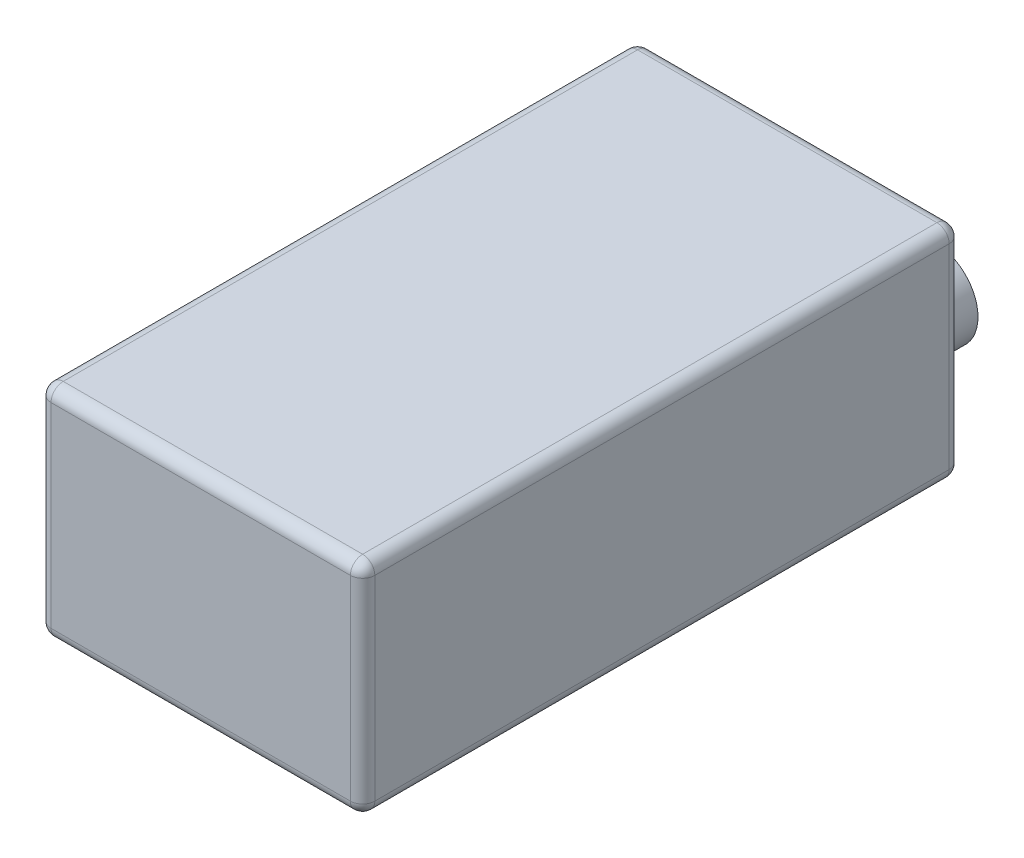
from build123d import *

# Parameters (mm, degrees)
ESQUISSE1_W        = 26.5
ESQUISSE1_H        = 49
BOSS_EXTRU_1_DEPTH = 18
CONG_1_R           = 1
ESQUISSE2_R        = 3.5
BOSS_EXTRU_2_DEPTH = 3


with BuildPart() as part:
    # Esquisse1 → Boss.-Extru.1 (new body)
    with BuildSketch(Plane(origin=(0, 0, 0), x_dir=(1, 0, 0), z_dir=(0, 1, 0))):
        Rectangle(ESQUISSE1_W, ESQUISSE1_H)
    extrude(amount=BOSS_EXTRU_1_DEPTH)

    # Congé1
    cong_1_edges = [part.edges().sort_by_distance(p)[0] for p in [
        (-13.25, 18, 0),
        (0, 18, 24.5),
        (13.25, 18, 0),
        (0, 0, 24.5),
        (-13.25, 0, 0),
        (0, 0, -24.5),
        (13.25, 0, 0),
        (13.25, 9, 24.5),
        (-13.25, 9, 24.5),
        (-13.25, 9, -24.5),
        (13.25, 9, -24.5),
        (0, 18, -24.5),
    ]]
    fillet(cong_1_edges, radius=CONG_1_R)

    # Esquisse2 → Boss.-Extru.2 (add)
    with BuildSketch(Plane(origin=(0, 0, -24.5), x_dir=(-1, 0, 0), z_dir=(0, 0, -1))):
        with Locations(Location((-8.113267723, 9, 0), (0, 0, 180))):
            Circle(ESQUISSE2_R)
    boss_extru_2 = extrude(amount=BOSS_EXTRU_2_DEPTH)

    # Symétrie1: Boss.-Extru.2 across plane
    add(boss_extru_2.mirror(Plane(origin=(0, 0, 0), x_dir=(0, 0, 1), z_dir=(1, 0, 0))))


solid = part.part
